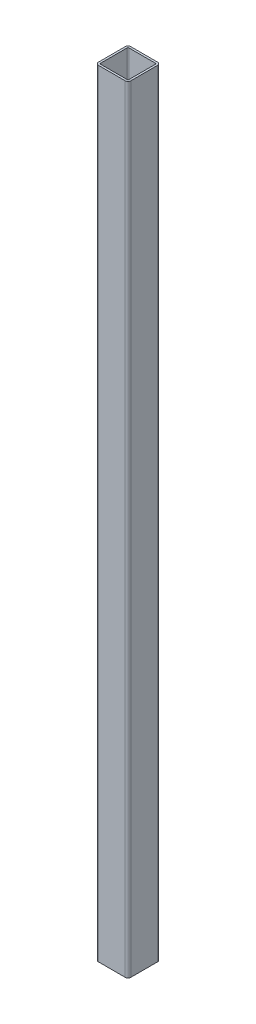
from build123d import *

# Parameters (mm, degrees)
BOSS_EXTRUDE1_DEPTH = 1219.2


with BuildPart() as part:
    # Sketch2 → Boss-Extrude1 (new body)
    with BuildSketch(Plane(origin=(0, 0, 0), x_dir=(1, 0, 0), z_dir=(0, 1, 0))):
        with BuildLine():
            Line((-20.955, -25.4), (20.955, -25.4))
            ThreePointArc((20.955, -25.4), (24.098089642, -24.098089642), (25.4, -20.955))
            Line((25.4, -20.955), (25.4, 20.955))
            ThreePointArc((25.4, 20.955), (24.098089642, 24.098089642), (20.955, 25.4))
            Line((20.955, 25.4), (-20.955, 25.4))
            ThreePointArc((-20.955, 25.4), (-24.098089642, 24.098089642), (-25.4, 20.955))
            Line((-25.4, 20.955), (-25.4, -20.955))
            ThreePointArc((-25.4, -20.955), (-24.098089642, -24.098089642), (-20.955, -25.4))
        make_face()
        with BuildLine():
            Line((-20.955, -22.225), (20.955, -22.225))
            ThreePointArc((20.955, -22.225), (21.853025612, -21.853025612), (22.225, -20.955))
            Line((22.225, -20.955), (22.225, 20.955))
            ThreePointArc((22.225, 20.955), (21.853025612, 21.853025612), (20.955, 22.225))
            Line((20.955, 22.225), (-20.955, 22.225))
            ThreePointArc((-20.955, 22.225), (-21.853025612, 21.853025612), (-22.225, 20.955))
            Line((-22.225, 20.955), (-22.225, -20.955))
            ThreePointArc((-22.225, -20.955), (-21.853025612, -21.853025612), (-20.955, -22.225))
        make_face(mode=Mode.SUBTRACT)
    extrude(amount=BOSS_EXTRUDE1_DEPTH)


solid = part.part
